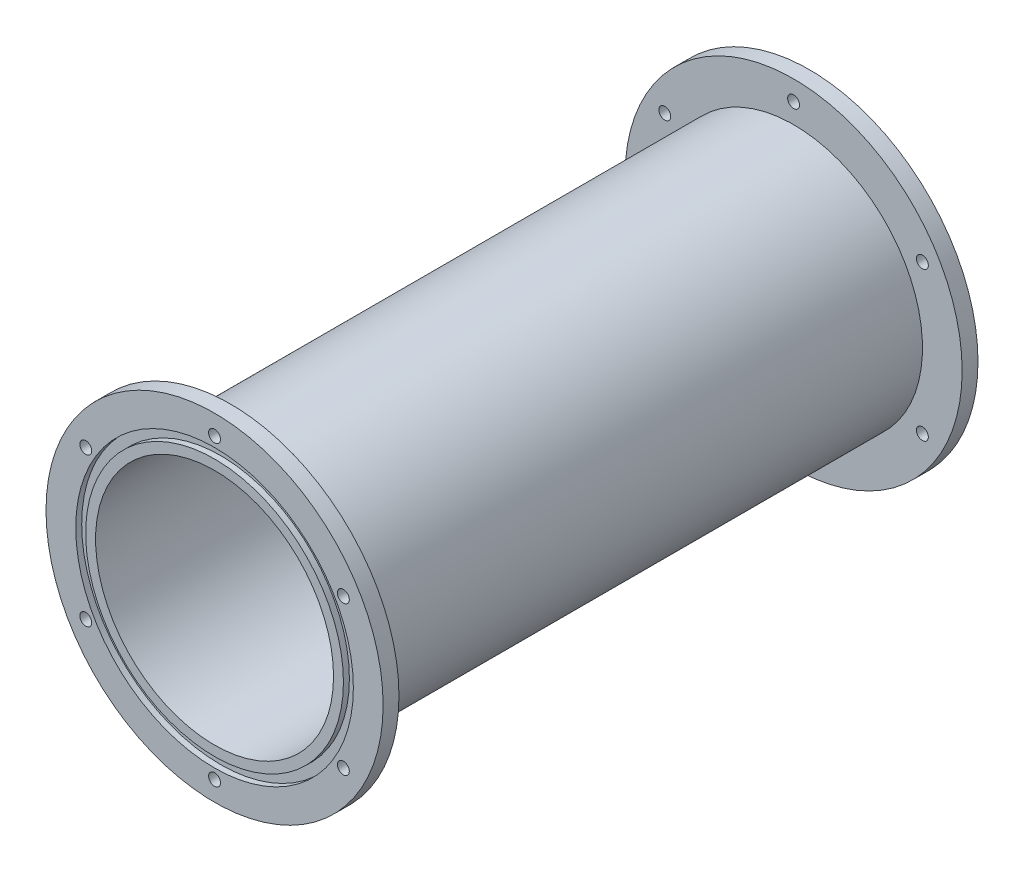
from build123d import *

# Parameters (mm, degrees)
SKETCH_1_R          = 65
SKETCH_1_R_2        = 60
EXTRUDE_1_DEPTH     = 150
SKETCH_2_R          = 85
SKETCH_2_R_2        = 3
SKETCH_2_R_3        = 65
EXTRUDE_2_DEPTH     = 8
SKETCH_3_R          = 70
SKETCH_3_R_2        = 65
CUT_EXTRUDE_1_DEPTH = 3


with BuildPart() as part:
    # 草图1 → 凸台-拉伸1 (new, symmetric)
    with BuildSketch(Plane.XY):
        Circle(SKETCH_1_R)
        Circle(SKETCH_1_R_2, mode=Mode.SUBTRACT)
    extrude(amount=EXTRUDE_1_DEPTH, both=True)

    # 草图2 → 凸台-拉伸2 (add)
    with BuildSketch(Plane.XY.offset(150)):
        Circle(SKETCH_2_R)
        with Locations((0, 75)):
            Circle(SKETCH_2_R_2, mode=Mode.SUBTRACT)
        with Locations((64.951905284, 37.5)):
            Circle(SKETCH_2_R_2, mode=Mode.SUBTRACT)
        with Locations((64.951905284, -37.5)):
            Circle(SKETCH_2_R_2, mode=Mode.SUBTRACT)
        with Locations((0, -75)):
            Circle(SKETCH_2_R_2, mode=Mode.SUBTRACT)
        with Locations((-64.951905284, -37.5)):
            Circle(SKETCH_2_R_2, mode=Mode.SUBTRACT)
        with Locations((-64.951905284, 37.5)):
            Circle(SKETCH_2_R_2, mode=Mode.SUBTRACT)
        Circle(SKETCH_2_R_3, mode=Mode.SUBTRACT)
    extrude_2 = extrude(amount=-EXTRUDE_2_DEPTH)

    # 草图3 → 切除-拉伸1 (cut)
    with BuildSketch(Plane.XY.offset(150)):
        Circle(SKETCH_3_R)
        Circle(SKETCH_3_R_2, mode=Mode.SUBTRACT)
    cut_extrude_1 = extrude(amount=-CUT_EXTRUDE_1_DEPTH, mode=Mode.SUBTRACT)

    # 镜向1: 凸台-拉伸2, 切除-拉伸1 across plane
    add(extrude_2.mirror(Plane.XY))
    add(cut_extrude_1.mirror(Plane.XY), mode=Mode.SUBTRACT)


solid = part.part
